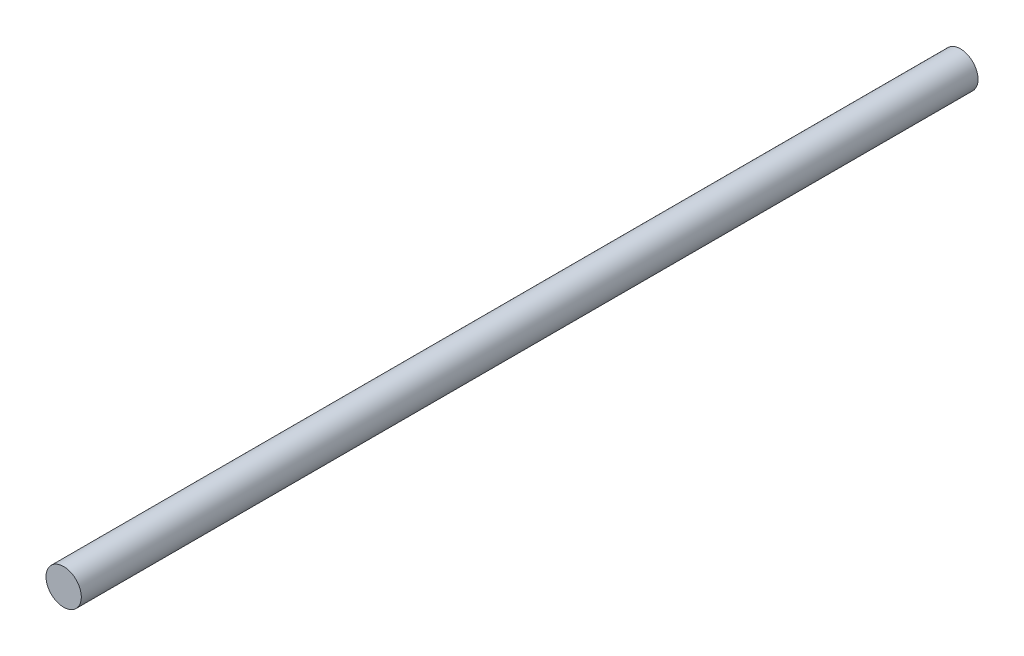
from build123d import *

# Parameters (mm, degrees)
SKETCH1_R           = 6
BOSS_EXTRUDE1_DEPTH = 304.8


with BuildPart() as part:
    # Sketch1 → Boss-Extrude1 (new body)
    with BuildSketch(Plane.XY):
        with Locations(Location((0, 0, 0), (0, 0, 180))):
            Circle(SKETCH1_R)
    extrude(amount=BOSS_EXTRUDE1_DEPTH)


solid = part.part
